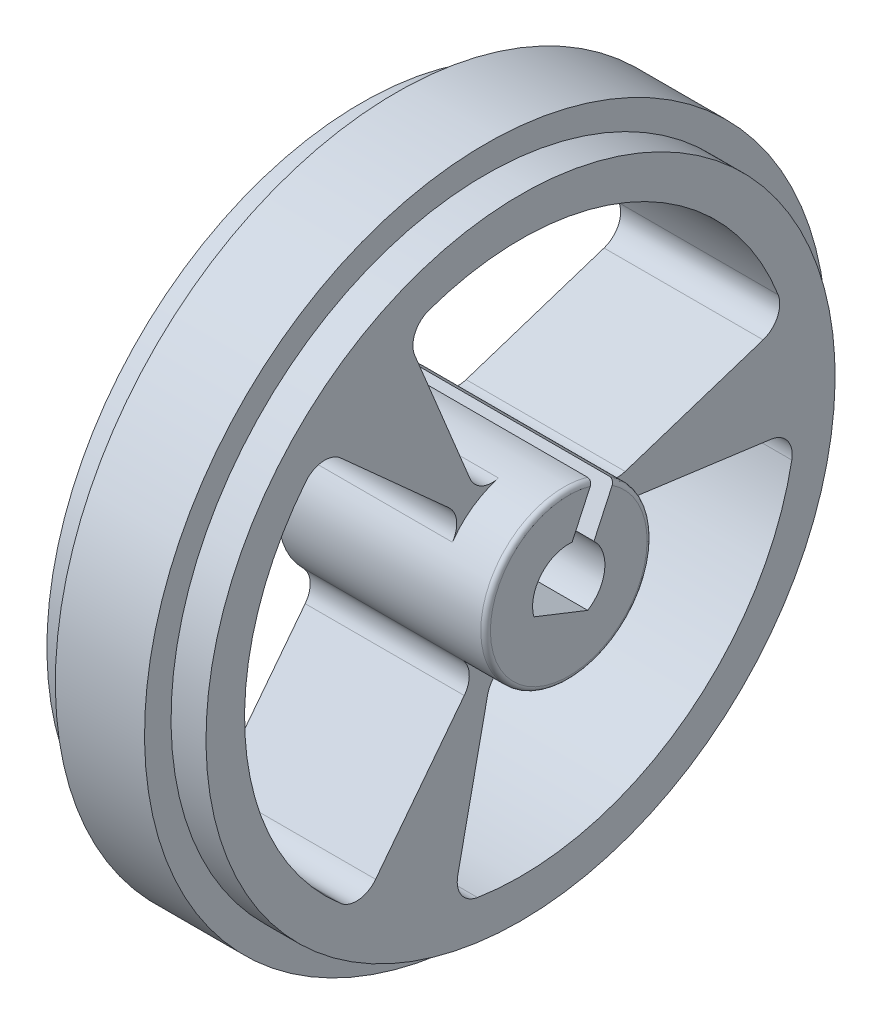
from build123d import *

# Parameters (mm, degrees)
ODEBRAT_VYSUNUT_M1_DEPTH = 10
ZAOBLIT1_R               = 1
ZAOBLIT2_R               = 1
ZAOBLIT4_R               = 1
ODEBRAT_VYSUNUT_M2_DEPTH = 10
P_IDAT_START             = 2
P_IDAT_VYSUNUT_M1_DEPTH  = 2
ZAOBLIT5_R               = 0.2


with BuildPart() as part:
    # Skica1 → Rotovat1 (revolve)
    with BuildSketch(Plane.XY, mode=Mode.PRIVATE) as rotovat1_sk:
        Polygon((1.849988347, 14.15), (-1.849988347, 14.15), (-1.849988347, 13.05), (-3.3, 13.05), (-3.3, 0), (3.3, 0), (3.3, 13.05), (1.849988347, 13.05), align=None)
    revolve(rotovat1_sk.sketch.rotate(Axis((-3.3, 0, 0), (1, 0, 0)), 180), axis=Axis((-3.3, 0, 0), (1, 0, 0)))

    # Skica2 → Odebrat vysunutím1 (cut)
    with BuildSketch(Plane(origin=(3.3, 0, 0), x_dir=(0, 0, -1), z_dir=(1, 0, 0))):
        with BuildLine():
            ThreePointArc((-1.725, 2.987787643), (1.446819914, 3.131966177), (3.393206272, 0.623418956))
            Line((3.393206272, 0.623418956), (11.018835658, 3.112516786))
            ThreePointArc((11.018835658, 3.112516786), (4.801764642, 10.394496444), (-4.773151875, 10.407666462))
            Line((-4.773151875, 10.407666462), (-1.725, 2.987787643))
        make_face()
        with BuildLine():
            ThreePointArc((-1.725, -2.987787643), (-3.43577223, -0.313000288), (-2.236499789, 2.626893354))
            Line((-2.236499789, 2.626893354), (-8.204936435, 7.986333207))
            ThreePointArc((-8.204936435, 7.986333207), (-11.402780301, -1.038798059), (-6.626727613, -9.33750401))
            Line((-6.626727613, -9.33750401), (-1.725, -2.987787643))
        make_face()
        with BuildLine():
            Line((11.399879487, -1.070162452), (3.45, 0))
            ThreePointArc((3.45, 0), (1.988952316, -2.818965889), (-1.156706483, -3.25031231))
            Line((-1.156706483, -3.25031231), (-2.813899223, -11.098849993))
            ThreePointArc((-2.813899223, -11.098849993), (6.601015659, -9.355698385), (11.399879487, -1.070162452))
        make_face()
    extrude(amount=-ODEBRAT_VYSUNUT_M1_DEPTH, mode=Mode.SUBTRACT)

    # Zaoblit1
    zaoblit1_edges = [part.edges().sort_by_distance(p)[0] for p in [
        (0, 7.986333207, 8.204936435),
    ]]
    fillet(zaoblit1_edges, radius=ZAOBLIT1_R)

    # Zaoblit2
    zaoblit2_edges = [part.edges().sort_by_distance(p)[0] for p in [
        (0, 10.407666462, 4.773151875),
        (0, 3.112516786, -11.018835658),
        (0, -9.33750401, 6.626727613),
        (0, -1.070162452, -11.399879487),
        (0, -11.098849993, 2.813899223),
    ]]
    fillet(zaoblit2_edges, radius=ZAOBLIT2_R)

    # Zaoblit4
    zaoblit4_edges = [part.edges().sort_by_distance(p)[0] for p in [
        (0, 0.623418956, -3.393206272),
        (0, 2.987787643, 1.725),
        (0, 2.626893354, 2.236499789),
        (0, -2.987787643, 1.725),
        (0, -3.25031231, 1.156706483),
        (0, 0, -3.45),
    ]]
    fillet(zaoblit4_edges, radius=ZAOBLIT4_R)

    # Skica3 → Odebrat vysunutím2 (cut)
    with BuildSketch(Plane(origin=(3.3, 0, 0), x_dir=(0, 0, -1), z_dir=(1, 0, 0))):
        with BuildLine():
            Line((1.046984184, 1.074162054), (1.885452924, 2.889215684))
            ThreePointArc((1.885452924, 2.889215684), (1.446819914, 3.131966177), (0.977636641, 3.308583775))
            Line((0.977636641, 3.308583775), (0.1391679, 1.493530146))
            ThreePointArc((0.1391679, 1.493530146), (-1.149085352, 0.964159143), (-1.446658447, -0.396458495))
            Line((-1.446658447, -0.396458495), (0.78566452, -1.277783731))
            ThreePointArc((0.78566452, -1.277783731), (1.490826134, -0.165642502), (1.046984184, 1.074162054))
        make_face()
    extrude(amount=-ODEBRAT_VYSUNUT_M2_DEPTH, mode=Mode.SUBTRACT)

    # Skica5 → Přidat vysunutím1 (add)
    with BuildSketch(Plane(origin=(3.3, 0, 0), x_dir=(0, 0, -1), z_dir=(1, 0, 0)).offset(P_IDAT_START)):
        with BuildLine():
            Line((0.977636641, 3.308583775), (0.1391679, 1.493530146))
            ThreePointArc((0.1391679, 1.493530146), (-1.149085352, 0.964159143), (-1.446658447, -0.396458495))
            Line((-1.446658447, -0.396458495), (0.78566452, -1.277783731))
            ThreePointArc((0.78566452, -1.277783731), (1.490826134, -0.165642502), (1.046984184, 1.074162054))
            Line((1.046984184, 1.074162054), (1.885452924, 2.889215684))
            ThreePointArc((1.885452924, 2.889215684), (-1.446819914, -3.131966177), (0.977636641, 3.308583775))
        make_face()
    extrude(amount=-P_IDAT_VYSUNUT_M1_DEPTH)

    # Zaoblit5
    zaoblit5_edges = [part.edges().sort_by_distance(p)[0] for p in [
        (5.3, -3.131966177, 1.446819914),
    ]]
    fillet(zaoblit5_edges, radius=ZAOBLIT5_R)


solid = part.part
